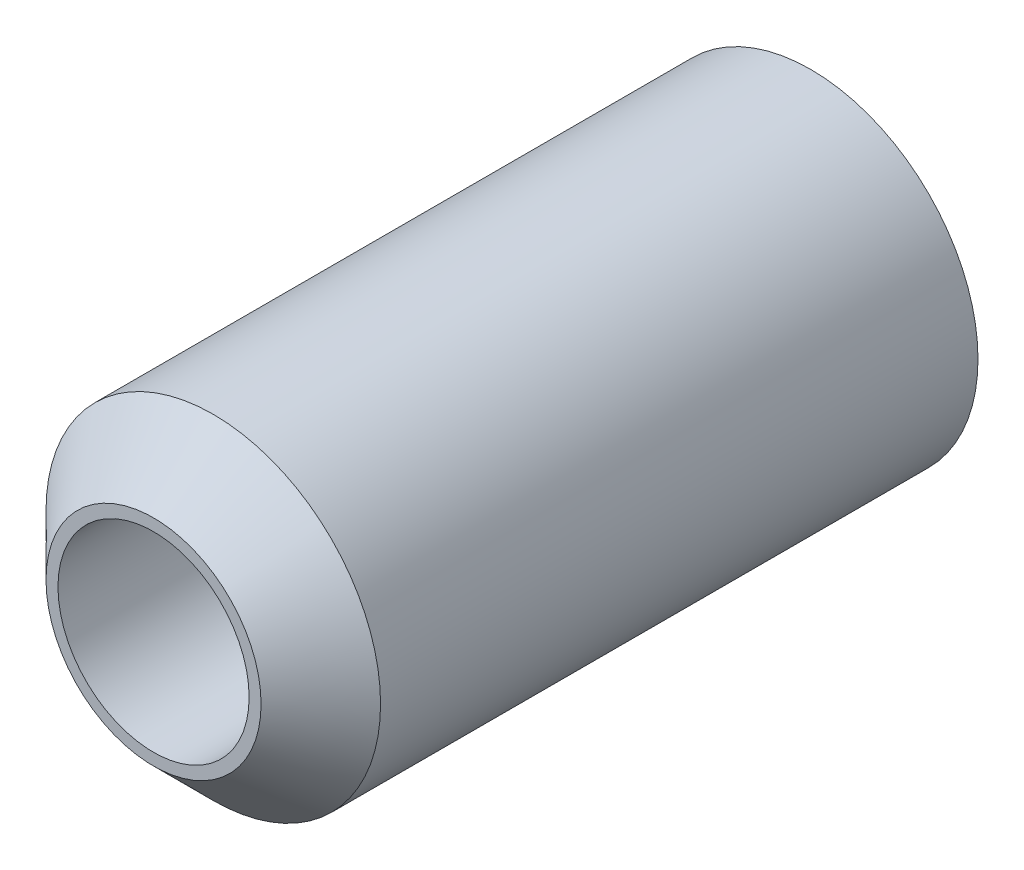
from build123d import *

# Parameters (mm, degrees)
SKETCH1_R           = 2.8
SKETCH1_R_2         = 1.6
BOSS_EXTRUDE1_DEPTH = 11
CHAMFER1_SIZE       = 1


with BuildPart() as part:
    # Sketch1 → Boss-Extrude1 (new body)
    with BuildSketch(Plane.XY):
        Circle(SKETCH1_R)
        Circle(SKETCH1_R_2, mode=Mode.SUBTRACT)
    extrude(amount=BOSS_EXTRUDE1_DEPTH)

    # Chamfer1
    chamfer1_edges = [part.edges().sort_by_distance(p)[0] for p in [
        (-2.8, 0, 11),
    ]]
    chamfer(chamfer1_edges, length=CHAMFER1_SIZE)


solid = part.part
